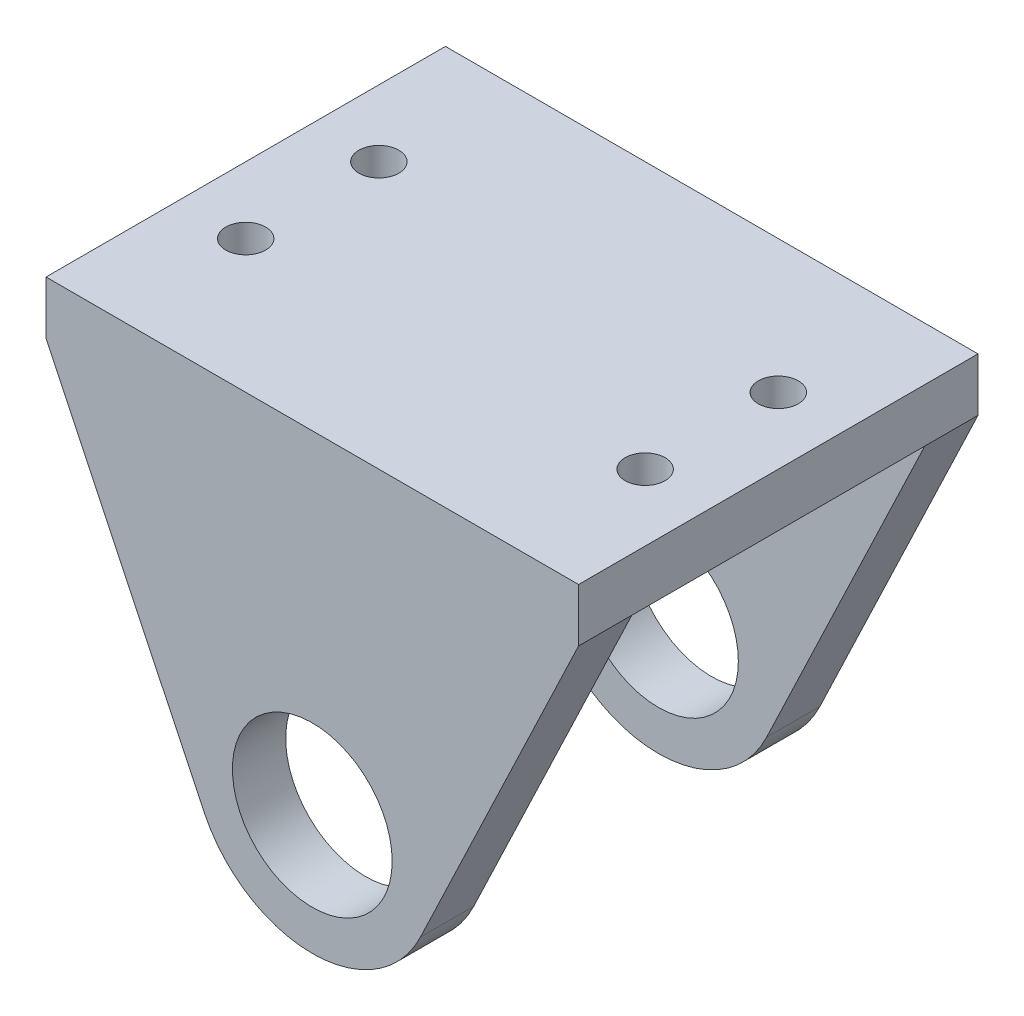
from build123d import *

# Parameters (mm, degrees)
SKETCH_1_W          = 40
SKETCH_1_H          = 20
EXTRUDE_1_DEPTH     = 4
SKETCH_2_R          = 6
EXTRUDE_2_DEPTH     = 5
SKETCH_3_W          = 40
SKETCH_3_H          = 35
CUT_EXTRUDE_1_DEPTH = 1
SKETCH_6_R          = 1.5
CUT_EXTRUDE_3_DEPTH = 10


with BuildPart() as part:
    # 草图1 → 凸台-拉伸1 (new body)
    with BuildSketch(Plane(origin=(0, 0, 0), x_dir=(1, 0, 0), z_dir=(0, 1, 0))):
        Rectangle(SKETCH_1_W, SKETCH_1_H)
    extrude(amount=-EXTRUDE_1_DEPTH)

    # 草图2 → 凸台-拉伸2 (add)
    with BuildSketch(Plane.XY.offset(10)):
        with BuildLine():
            Line((20, -4), (20, 0))
            Line((20, 0), (-20, 0))
            Line((-20, 0), (-20, -4))
            Line((-20, -4), (-8.121724647, -28.877832997))
            ThreePointArc((-8.121724647, -28.877832997), (0, -34), (8.121724647, -28.877832997))
            Line((8.121724647, -28.877832997), (20, -4))
        make_face()
        with Locations((0, -25)):
            Circle(SKETCH_2_R, mode=Mode.SUBTRACT)
    extrude_2 = extrude(amount=EXTRUDE_2_DEPTH)

    # 草图3 → 切除-拉伸1 (cut)
    with BuildSketch(Plane(origin=(0, 0, 10), x_dir=(-1, 0, 0), z_dir=(0, 0, -1))):
        with Locations((0, -21.5)):
            Rectangle(SKETCH_3_W, SKETCH_3_H)
    cut_extrude_1 = extrude(amount=-CUT_EXTRUDE_1_DEPTH, mode=Mode.SUBTRACT)

    # 镜向1: 凸台-拉伸2, 切除-拉伸1 across plane
    add(extrude_2.mirror(Plane.XY))
    add(cut_extrude_1.mirror(Plane.XY), mode=Mode.SUBTRACT)

    # 草图6 → 切除-拉伸3 (cut)
    with BuildSketch(Plane.XZ.offset(4)):
        with Locations(Location((-15, 5, 0), (0, 0, 270))):
            Circle(SKETCH_6_R)
        with Locations(Location((15, 5, 0), (0, 0, 270))):
            Circle(SKETCH_6_R)
        with Locations(Location((-15, -5, 0), (0, 0, 270))):
            Circle(SKETCH_6_R)
        with Locations(Location((15, -5, 0), (0, 0, 270))):
            Circle(SKETCH_6_R)
    extrude(amount=-CUT_EXTRUDE_3_DEPTH, mode=Mode.SUBTRACT)


solid = part.part
